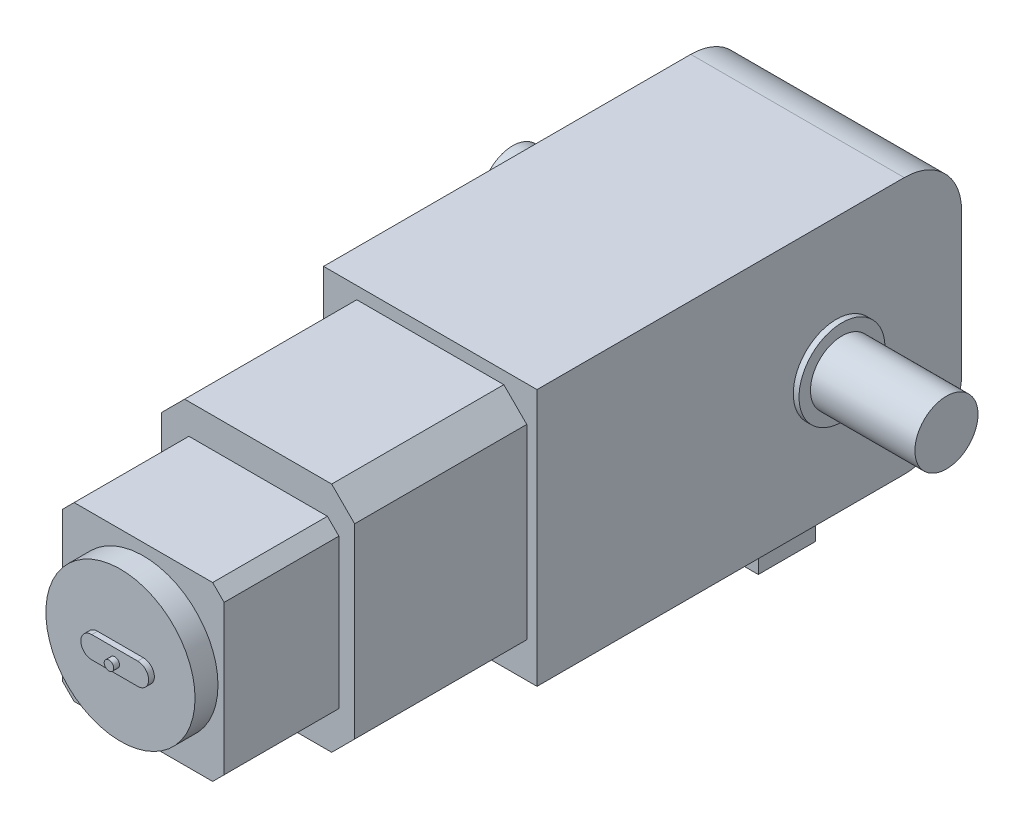
from build123d import *

# Parameters (mm, degrees)
BOSS_EXTRUDE2_DEPTH      = 18.6
BOSS_EXTRUDE3_DEPTH      = 1
BOSS_EXTRUDE3_DEPTH_BACK = 1
SKETCH4_R                = 0.75
CUT_EXTRUDE1_DEPTH       = 47.139462502
BOSS_EXTRUDE5_DEPTH      = 15
BOSS_EXTRUDE6_DEPTH      = 10
SKETCH7_R                = 6.5
BOSS_EXTRUDE7_DEPTH      = 2
BOSS_EXTRUDE8_DEPTH      = 0.5
SKETCH9_R                = 0.414833025
BOSS_EXTRUDE9_DEPTH      = 0.5
SKETCH11_R               = 3.745995244
BOSS_EXTRUDE10_DEPTH     = 0.5
SKETCH13_R               = 3.818916781
BOSS_EXTRUDE11_DEPTH     = 0.5
SKETCH14_R               = 2.75
BOSS_EXTRUDE12_DEPTH     = 9.1
BOSS_EXTRUDE13_START     = 9.1
SKETCH12_R               = 2.75
BOSS_EXTRUDE13_DEPTH     = 9.1
SKETCH15_W               = 4
SKETCH15_H               = 5
BOSS_EXTRUDE14_DEPTH     = 5


with BuildPart() as part:
    # Sketch2 → Boss-Extrude2 (new body)
    with BuildSketch(Plane(origin=(0, 0, 0), x_dir=(0, 0, -1), z_dir=(1, 0, 0))):
        with BuildLine():
            Line((0, 0), (32, 0))
            ThreePointArc((32, 0), (35.535533906, -1.464466094), (37, -5))
            Line((37, -5), (37, -17.4))
            ThreePointArc((37, -17.4), (35.535533906, -20.935533906), (32, -22.4))
            Line((32, -22.4), (0, -22.4))
            Line((0, -22.4), (0, 0))
        make_face()
    extrude(amount=-BOSS_EXTRUDE2_DEPTH)

    # Sketch3 → Boss-Extrude3 (add, two sides: drawn at the far end of the back side and taken through both)
    with BuildSketch(Plane(origin=(-9.3, 0, 0), x_dir=(0, 0, -1), z_dir=(1, 0, 0)).offset(-BOSS_EXTRUDE3_DEPTH_BACK)):
        with BuildLine():
            Line((39, -11.987468366), (39, -10.987468366))
            ThreePointArc((39, -10.987468366), (38.853553391, -10.633914975), (38.5, -10.487468366))
            Line((38.5, -10.487468366), (37, -10.487468366))
            Line((37, -10.487468366), (37, -12.487468366))
            Line((37, -12.487468366), (38.5, -12.487468366))
            ThreePointArc((38.5, -12.487468366), (38.853553391, -12.341021757), (39, -11.987468366))
        make_face()
    extrude(amount=BOSS_EXTRUDE3_DEPTH + BOSS_EXTRUDE3_DEPTH_BACK)

    # Sketch4 → Cut-Extrude1 (cut, through all)
    with BuildSketch(Plane(origin=(-8.3, 0, 0), x_dir=(0, 0, -1), z_dir=(1, 0, 0))):
        with Locations((37.841364182, -11.483102308)):
            Circle(SKETCH4_R)
    extrude(amount=-CUT_EXTRUDE1_DEPTH, mode=Mode.SUBTRACT)

    # Sketch5 → Boss-Extrude5 (add)
    with BuildSketch(Plane.XY):
        Polygon((-15.706913813, -21.324455345), (-2.893086187, -21.324455345), (-0.893086187, -19.324455345), (-0.893086187, -3.075544655), (-2.893086187, -1.075544655), (-15.706913813, -1.075544655), (-17.706913813, -3.075544655), (-17.706913813, -19.324455345), align=None)
    extrude(amount=BOSS_EXTRUDE5_DEPTH)

    # Sketch6 → Boss-Extrude6 (add)
    with BuildSketch(Plane.XY.offset(15)):
        Polygon((-15.335098918, -3.69274237), (-3.264901082, -3.69274237), (-2.264901082, -4.69274237), (-2.264901082, -17.70725763), (-3.264901082, -18.70725763), (-15.335098918, -18.70725763), (-16.335098918, -17.70725763), (-16.335098918, -4.69274237), align=None)
    extrude(amount=BOSS_EXTRUDE6_DEPTH)

    # Sketch7 → Boss-Extrude7 (add)
    with BuildSketch(Plane.XY.offset(25)):
        with Locations((-9.3, -11.2)):
            Circle(SKETCH7_R)
    extrude(amount=BOSS_EXTRUDE7_DEPTH)

    # Sketch8 → Boss-Extrude8 (add)
    with BuildSketch(Plane.XY.offset(27)):
        with BuildLine():
            Line((-11.3, -10.387788461), (-7.3, -10.387788461))
            ThreePointArc((-7.3, -10.387788461), (-6.346187608, -11.341600853), (-7.3, -12.295413245))
            Line((-7.3, -12.295413245), (-11.3, -12.295413245))
            ThreePointArc((-11.3, -12.295413245), (-12.253812392, -11.341600853), (-11.3, -10.387788461))
        make_face()
    extrude(amount=BOSS_EXTRUDE8_DEPTH)

    # Sketch9 → Boss-Extrude9 (add)
    with BuildSketch(Plane.XY.offset(27.5)):
        with Locations((-9.3, -11.473161183)):
            Circle(SKETCH9_R)
    extrude(amount=BOSS_EXTRUDE9_DEPTH)

    # Sketch11 → Boss-Extrude10 (add)
    with BuildSketch(Plane(origin=(0, 0, 0), x_dir=(0, 0, -1), z_dir=(1, 0, 0))):
        with Locations((26.079029107, -11.483102308)):
            Circle(SKETCH11_R)
    extrude(amount=BOSS_EXTRUDE10_DEPTH)

    # Sketch13 → Boss-Extrude11 (add)
    with BuildSketch(Plane.ZY.offset(18.6)):
        with Locations(Location((-26.079029107, -11.483102308, 0), (0, 0, 180))):
            Circle(SKETCH13_R)
    extrude(amount=BOSS_EXTRUDE11_DEPTH)

    # Sketch14 → Boss-Extrude12 (add)
    with BuildSketch(Plane.ZY.offset(19.1)):
        with Locations((-26.079029107, -11.483102308)):
            Circle(SKETCH14_R)
    extrude(amount=BOSS_EXTRUDE12_DEPTH)

    # Sketch12 → Boss-Extrude13 (add)
    with BuildSketch(Plane(origin=(0.5, 0, 0), x_dir=(0, 0, -1), z_dir=(1, 0, 0)).offset(BOSS_EXTRUDE13_START)):
        with Locations(Location((26.079029107, -11.483102308, 0), (0, 0, 180))):
            Circle(SKETCH12_R)
    extrude(amount=-BOSS_EXTRUDE13_DEPTH)

    # Sketch15 → Boss-Extrude14 (add)
    with BuildSketch(Plane.XZ.offset(22.4)):
        with Locations((-5.8, -25.582825972)):
            Rectangle(SKETCH15_W, SKETCH15_H)
        with Locations((-12.8, -25.582825972)):
            Rectangle(SKETCH15_W, SKETCH15_H)
    extrude(amount=BOSS_EXTRUDE14_DEPTH)


solid = part.part
